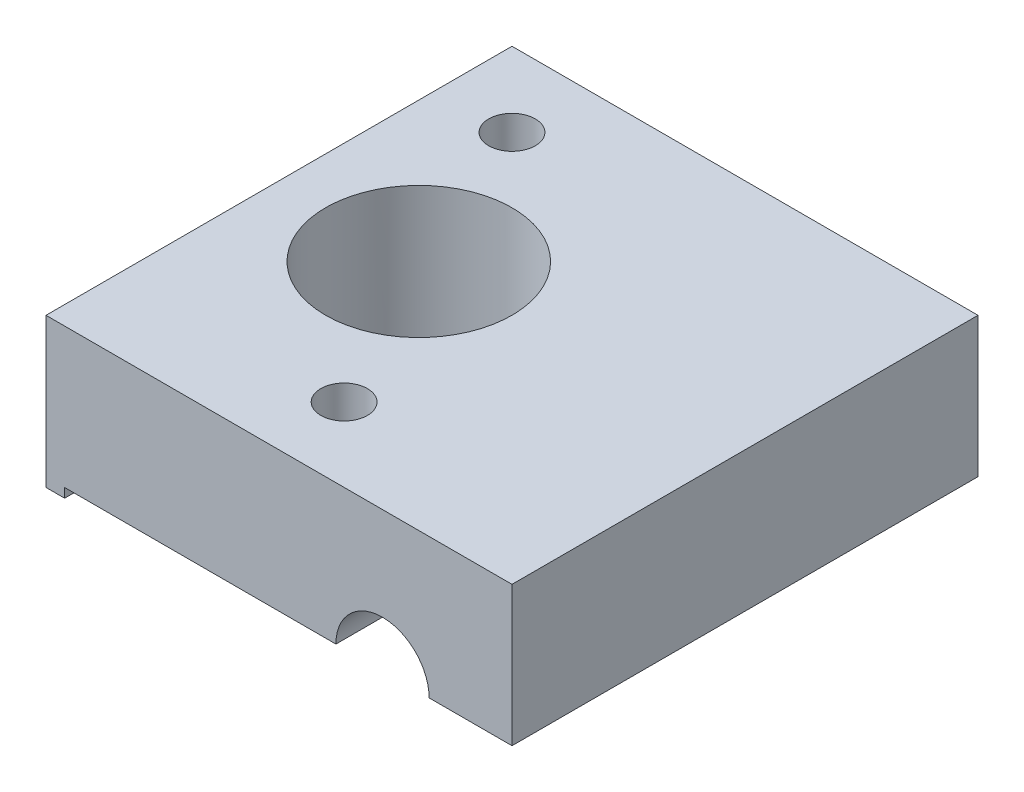
from build123d import *

# Parameters (mm, degrees)
BOSS_EXTRU_1_DEPTH      = 50
TROU_TARAUD_M61_D       = 5
ESQUISSE4_W             = 2
ESQUISSE4_H             = 50
BOSS_EXTRU_2_DEPTH      = 1
ESQUISSE5_R             = 10
ENL_V_MAT_EXTRU_1_DEPTH = 64.716654463


with BuildPart() as part:
    # Esquisse1 → Boss.-Extru.1 (new body)
    with BuildSketch(Plane.XY):
        with BuildLine():
            Line((-36.108337762, 0), (-36.108337762, 15))
            Line((-36.108337762, 15), (13.891662238, 15))
            Line((13.891662238, 15), (13.891662238, 0))
            Line((13.891662238, 0), (5, 0))
            ThreePointArc((5, 0), (0, 5), (-5, 0))
            Line((-5, 0), (-36.108337762, 0))
        make_face()
    extrude(amount=BOSS_EXTRU_1_DEPTH)

    # Trou taraudé M61 (through all)
    with Locations(Plane(origin=(0, 0, 0), x_dir=(-1, 0, 0), z_dir=(0, -1, 0))):
        with Locations((12.056043545, -42.065822787), (28.108337762, -8)):
            Hole(TROU_TARAUD_M61_D / 2)

    # Esquisse4 → Boss.-Extru.2 (add)
    with BuildSketch(Plane.XZ):
        with Locations((-35.108337762, 25)):
            Rectangle(ESQUISSE4_W, ESQUISSE4_H)
    extrude(amount=BOSS_EXTRU_2_DEPTH)

    # Esquisse5 → Enlèv. mat.-Extru.1 (cut, through all)
    with BuildSketch(Plane(origin=(0, 15, 0), x_dir=(1, 0, 0), z_dir=(0, 1, 0))):
        with Locations(Location((-21.108337762, -25, 0), (0, 0, 270))):
            Circle(ESQUISSE5_R)
    extrude(amount=-ENL_V_MAT_EXTRU_1_DEPTH, mode=Mode.SUBTRACT)


solid = part.part
